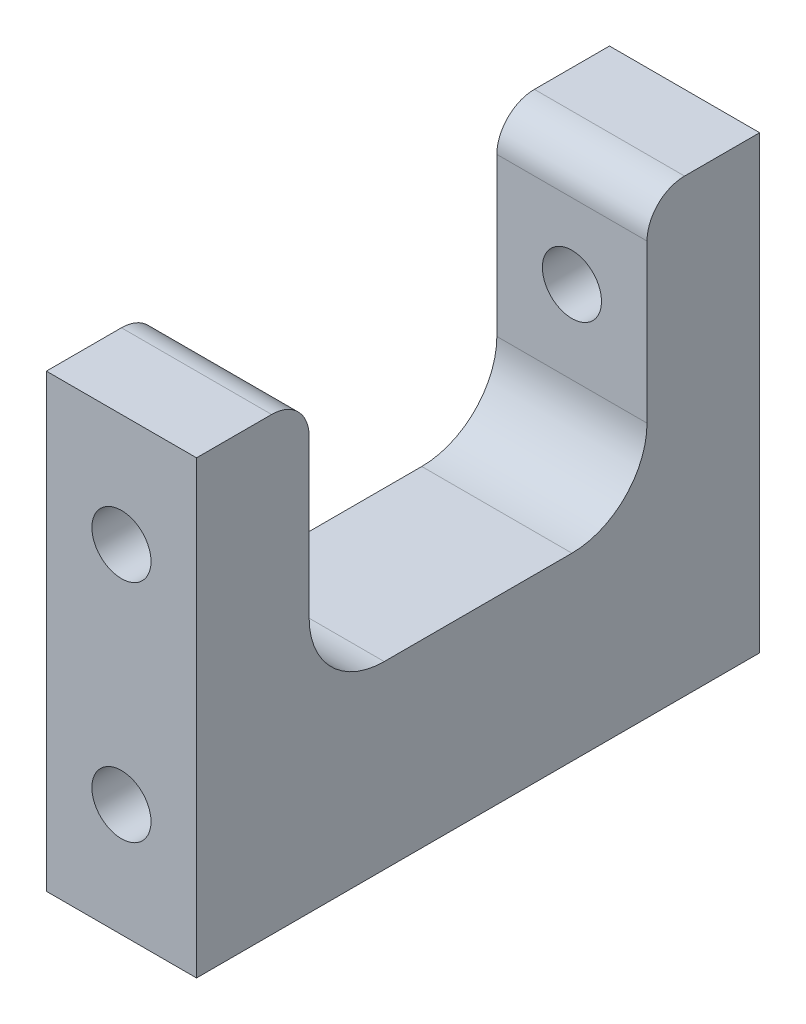
from build123d import *

# Parameters (mm, degrees)
SKETCH1_W                      = 6.35
SKETCH1_H                      = 19.05
BOSS_EXTRUDE2_DEPTH            = 23.8125
SKETCH2_W                      = 14.2875
SKETCH2_H                      = 11.43
WHEEL_SLOT_DEPTH               = 27.421265701
M3X0_5_TAPPED_HOLE1_AT_2_COUNT = 2
M3X0_5_TAPPED_HOLE1_AT_2_PITCH = 9.525
FILLET1_R                      = 3.175
FILLET2_R                      = 1.5875


with BuildPart() as part:
    # Sketch1 → Boss-Extrude2 (new body)
    with BuildSketch(Plane.XY):
        Rectangle(SKETCH1_W, SKETCH1_H)
    extrude(amount=BOSS_EXTRUDE2_DEPTH)

    # Sketch2 → WHEEL-SLOT (cut, through all)
    with BuildSketch(Plane(origin=(3.175, 0, 0), x_dir=(0, 0, -1), z_dir=(1, 0, 0))):
        with Locations((-11.90625, 3.81)):
            Rectangle(SKETCH2_W, SKETCH2_H)
    extrude(amount=-WHEEL_SLOT_DEPTH, mode=Mode.SUBTRACT)

    # Sketch4 → M3x0.5 Tapped Hole1 (revolve, cut)
    with BuildSketch(Plane(origin=(0, -4.7625, 23.8125), x_dir=(0, -1, 0), z_dir=(1, 0, 0))):
        Polygon((0, 0), (0, 10.657075774), (1.25, 9.906), (1.25, 0), align=None)
    m3x0_5_tapped_hole1 = revolve(axis=Axis((0, -4.7625, 30.1625), (0, 0, -1)), mode=Mode.SUBTRACT)

    # M3x0.5 Tapped Hole1 at 2: M3x0.5 Tapped Hole1 ×2
    with Locations(*[(0, i * M3X0_5_TAPPED_HOLE1_AT_2_PITCH, 0) for i in range(1, M3X0_5_TAPPED_HOLE1_AT_2_COUNT)]):
        add(m3x0_5_tapped_hole1, mode=Mode.SUBTRACT)

    # M3-TAPPED-MIR: M3x0.5 Tapped Hole1 across plane
    add(m3x0_5_tapped_hole1.mirror(Plane.XY.offset(11.90625)), mode=Mode.SUBTRACT)

    # M3-TAPPED-MIR copy 1 sketch → M3-TAPPED-MIR copy 1 (revolve, cut)
    with BuildSketch(Plane(origin=(0, 4.7625, 0), x_dir=(0, -1, 0), z_dir=(1, 0, 0))):
        Polygon((0, 0), (0, -10.657075774), (1.25, -9.906), (1.25, 0), align=None)
    revolve(axis=Axis((0, 4.7625, -6.35), (0, 0, -1)), mode=Mode.SUBTRACT)

    # Fillet1
    fillet1_edges = [part.edges().sort_by_distance(p)[0] for p in [
        (0, -1.905, 19.05),
        (0, -1.905, 4.7625),
    ]]
    fillet(fillet1_edges, radius=FILLET1_R)

    # Fillet2
    fillet2_edges = [part.edges().sort_by_distance(p)[0] for p in [
        (0, 9.525, 19.05),
        (0, 9.525, 4.7625),
    ]]
    fillet(fillet2_edges, radius=FILLET2_R)


solid = part.part
